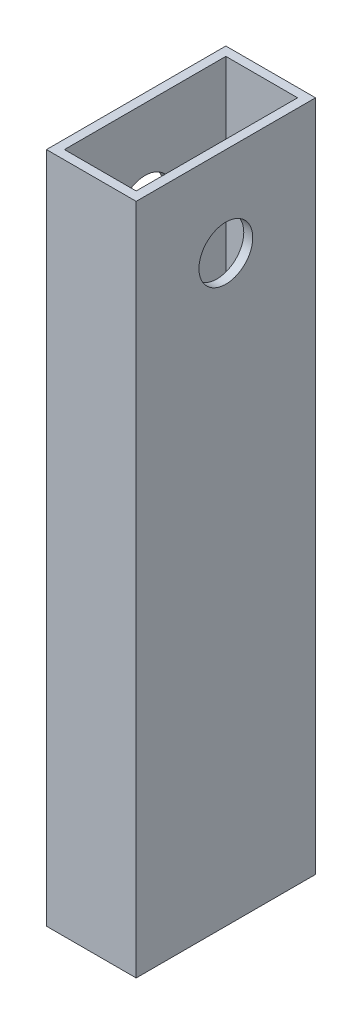
from build123d import *

# Parameters (mm, degrees)
SKETCH1_W           = 10
SKETCH1_H           = 20
SKETCH1_W_2         = 8
SKETCH1_H_2         = 18
BOSS_EXTRUDE1_DEPTH = 75
SKETCH2_R           = 3
CUT_EXTRUDE1_DEPTH  = 77.321687612


with BuildPart() as part:
    # Sketch1 → Boss-Extrude1 (new body)
    with BuildSketch(Plane(origin=(0, 0, 0), x_dir=(1, 0, 0), z_dir=(0, 1, 0))):
        Rectangle(SKETCH1_W, SKETCH1_H)
        Rectangle(SKETCH1_W_2, SKETCH1_H_2, mode=Mode.SUBTRACT)
    extrude(amount=BOSS_EXTRUDE1_DEPTH)

    # Sketch2 → Cut-Extrude1 (cut, through all)
    with BuildSketch(Plane(origin=(5, 0, 0), x_dir=(0, 0, -1), z_dir=(1, 0, 0))):
        with Locations((0, 65)):
            Circle(SKETCH2_R)
    extrude(amount=-CUT_EXTRUDE1_DEPTH, mode=Mode.SUBTRACT)


solid = part.part
